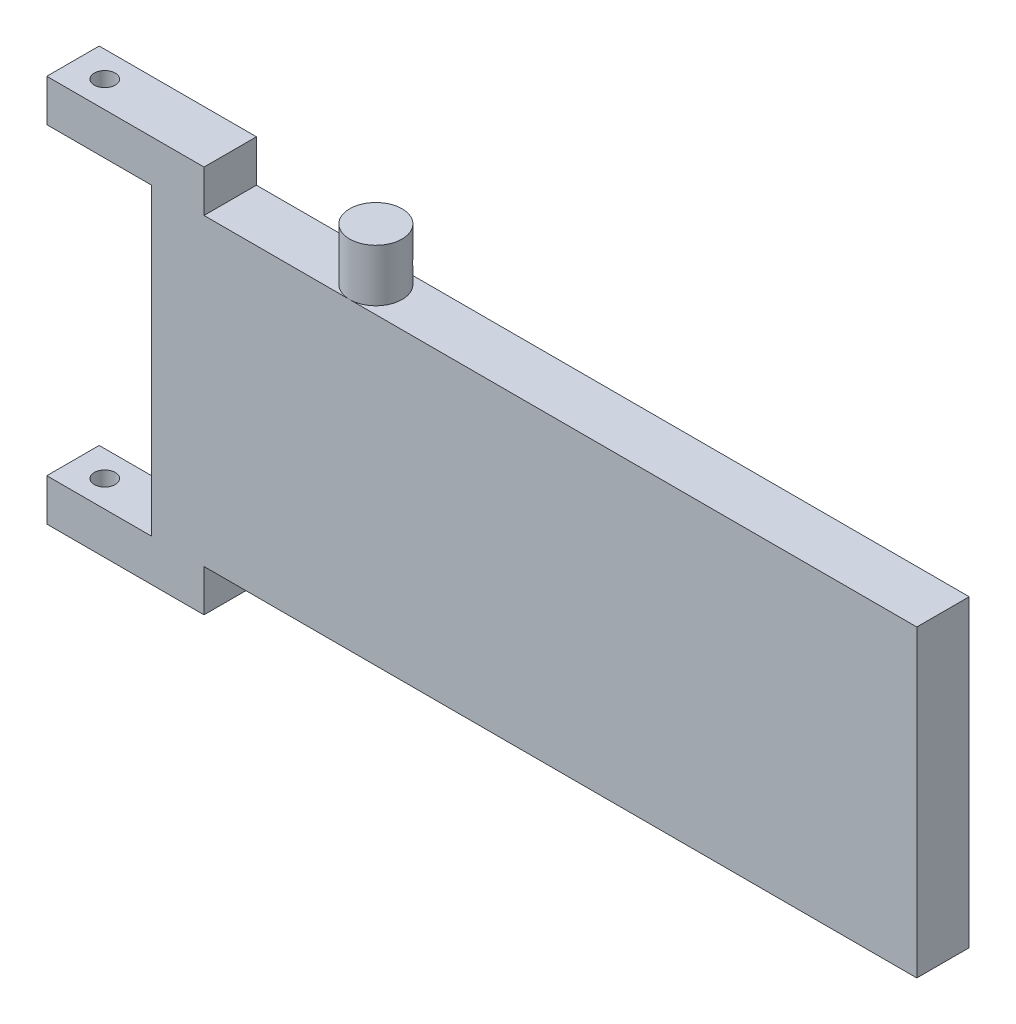
from build123d import *

# Parameters (mm, degrees)
SKETCH1_W           = 73
SKETCH1_H           = 29
BOSS_EXTRUDE1_DEPTH = 5
SKETCH2_R           = 1
CUT_EXTRUDE1_DEPTH  = 35
SKETCH3_W           = 4
SKETCH3_H           = 6
BOSS_EXTRUDE2_DEPTH = 5
SKETCH4_W           = 3
SKETCH4_H           = 2
CUT_EXTRUDE2_DEPTH  = 10
SKETCH5_R           = 2.5
BOSS_EXTRUDE3_DEPTH = 5
CUT_EXTRUDE3_DEPTH  = 25
FILLET1_R           = 1


with BuildPart() as part:
    # Sketch1 → Boss-Extrude1 (new body)
    with BuildSketch(Plane.XY):
        with Locations((36.5, 14.5)):
            Rectangle(SKETCH1_W, SKETCH1_H)
        Polygon((-10, 29), (0, 29), (5, 29), (5, 33), (-10, 33), align=None)
        Polygon((5, 0), (0, 0), (-10, 0), (-10, -4), (5, -4), align=None)
    extrude(amount=BOSS_EXTRUDE1_DEPTH)

    # Sketch2 → Cut-Extrude1 (cut)
    with BuildSketch(Plane(origin=(0, 33, 0), x_dir=(1, 0, 0), z_dir=(0, 1, 0))):
        with Locations(Location((-7, -2.46940408, 0), (0, 0, 270))):
            Circle(SKETCH2_R)
    extrude(amount=-CUT_EXTRUDE1_DEPTH, mode=Mode.SUBTRACT)

    # Sketch3 → Boss-Extrude2 (add)
    with BuildSketch(Plane(origin=(0, 0, 0), x_dir=(-1, 0, 0), z_dir=(0, 0, -1))):
        with Locations((-36, 20)):
            Rectangle(SKETCH3_W, SKETCH3_H)
    extrude(amount=BOSS_EXTRUDE2_DEPTH)

    # Sketch4 → Cut-Extrude2 (cut)
    with BuildSketch(Plane(origin=(38, 0, 0), x_dir=(0, 0, -1), z_dir=(1, 0, 0))):
        with Locations((1.5, 20)):
            Rectangle(SKETCH4_W, SKETCH4_H)
    extrude(amount=-CUT_EXTRUDE2_DEPTH, mode=Mode.SUBTRACT)

    # Sketch5 → Boss-Extrude3 (add)
    with BuildSketch(Plane(origin=(0, 29, 0), x_dir=(1, 0, 0), z_dir=(0, 1, 0))):
        with Locations(Location((18.894998898, -2.5, 0), (0, 0, 270))):
            Circle(SKETCH5_R)
    extrude(amount=BOSS_EXTRUDE3_DEPTH)

    # Sketch6 → Cut-Extrude3 (cut)
    with BuildSketch(Plane(origin=(5, 0, 0), x_dir=(0, 0, -1), z_dir=(1, 0, 0))):
        Polygon((0, 33), (-1, 31), (0, 29), align=None)
    extrude(amount=CUT_EXTRUDE3_DEPTH, mode=Mode.SUBTRACT)

    # Fillet1
    fillet1_edges = [part.edges().sort_by_distance(p)[0] for p in [
        (34, 20, -3),
        (38, 20, -3),
    ]]
    fillet(fillet1_edges, radius=FILLET1_R)


solid = part.part
